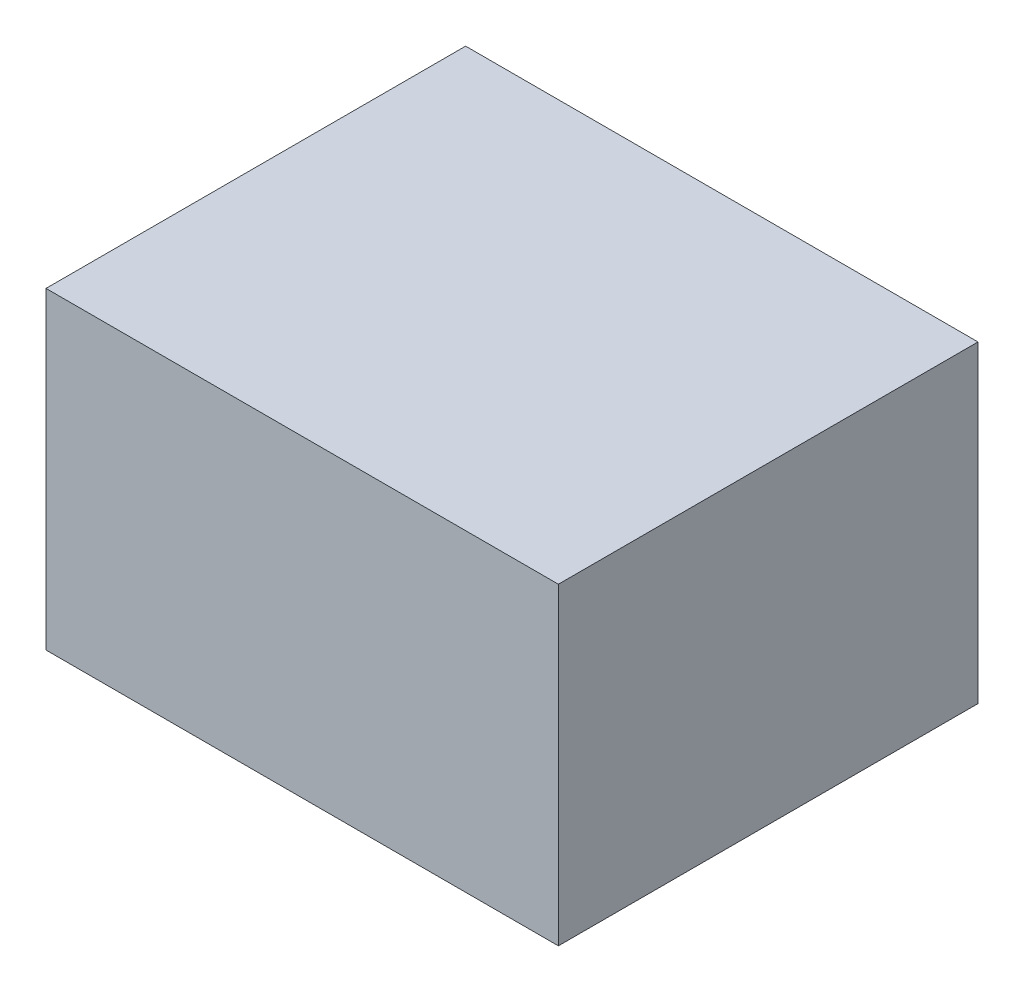
from build123d import *

# Parameters (mm, degrees)
SKETCH1_W           = 12.76
SKETCH1_H           = 7.8
BOSS_EXTRUDE1_DEPTH = 10.45


with BuildPart() as part:
    # Sketch1 → Boss-Extrude1 (new body)
    with BuildSketch(Plane.XY):
        Rectangle(SKETCH1_W, SKETCH1_H)
    extrude(amount=BOSS_EXTRUDE1_DEPTH)


solid = part.part
